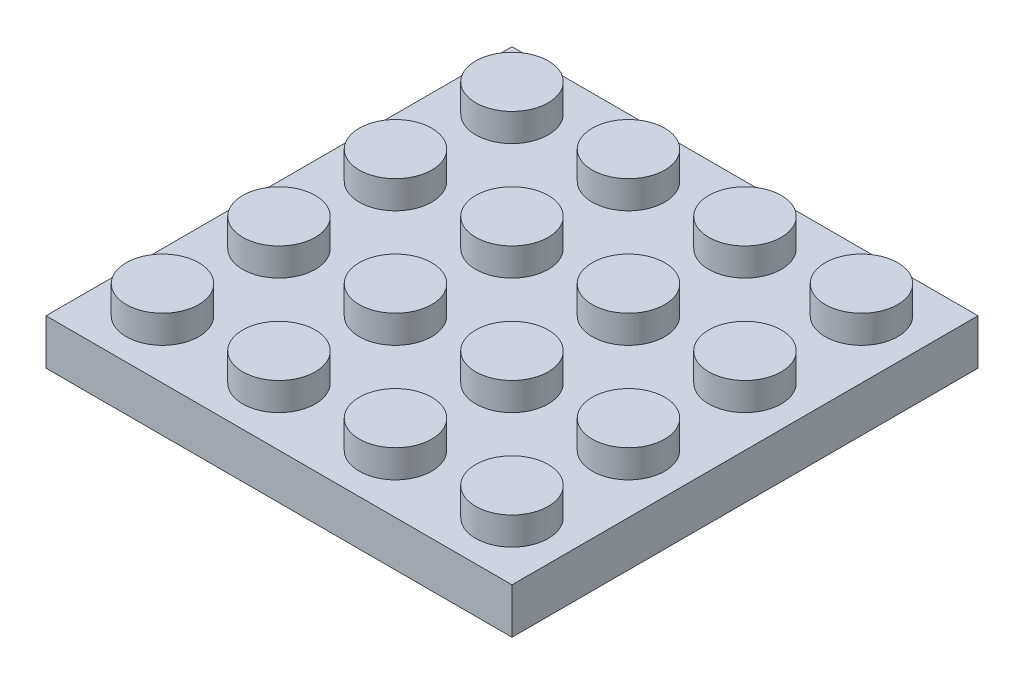
from build123d import *

# Parameters (mm, degrees)
SKETCH1_W           = 31.8
SKETCH1_H           = 31.8
BOSS_EXTRUDE1_DEPTH = 3.1
SKETCH2_W           = 28.8
SKETCH2_H           = 28.8
CUT_EXTRUDE1_DEPTH  = 1.9
SKETCH3_R           = 2.475
BOSS_EXTRUDE2_DEPTH = 1.9


with BuildPart() as part:
    # Sketch1 → Boss-Extrude1 (new body)
    with BuildSketch(Plane(origin=(0, 0, 0), x_dir=(1, 0, 0), z_dir=(0, 1, 0))):
        with Locations((-34.664493697, 17.966451592)):
            Rectangle(SKETCH1_W, SKETCH1_H)
    extrude(amount=BOSS_EXTRUDE1_DEPTH)

    # Sketch2 → Cut-Extrude1 (cut)
    with BuildSketch(Plane.XZ):
        with Locations((-34.664493697, -17.966451592)):
            Rectangle(SKETCH2_W, SKETCH2_H)
    extrude(amount=-CUT_EXTRUDE1_DEPTH, mode=Mode.SUBTRACT)

    # Sketch3 → Boss-Extrude2 (add)
    with BuildSketch(Plane(origin=(0, 3.1, 0), x_dir=(1, 0, 0), z_dir=(0, 1, 0))):
        with Locations(Location((-46.589493697, 29.891451592, 0), (0, 0, 90))):
            Circle(SKETCH3_R)
        with Locations(Location((-30.689493697, 29.891451592, 0), (0, 0, 90))):
            Circle(SKETCH3_R)
        with Locations(Location((-38.639493697, 29.891451592, 0), (0, 0, 90))):
            Circle(SKETCH3_R)
        with Locations(Location((-22.739493697, 29.891451592, 0), (0, 0, 90))):
            Circle(SKETCH3_R)
        with Locations(Location((-46.589493697, 21.941451592, 0), (0, 0, 90))):
            Circle(SKETCH3_R)
        with Locations(Location((-38.639493697, 21.941451592, 0), (0, 0, 90))):
            Circle(SKETCH3_R)
        with Locations(Location((-30.689493697, 21.941451592, 0), (0, 0, 90))):
            Circle(SKETCH3_R)
        with Locations(Location((-22.739493697, 21.941451592, 0), (0, 0, 90))):
            Circle(SKETCH3_R)
        with Locations(Location((-22.739493697, 13.991451592, 0), (0, 0, 90))):
            Circle(SKETCH3_R)
        with Locations(Location((-22.739493697, 6.041451592, 0), (0, 0, 90))):
            Circle(SKETCH3_R)
        with Locations(Location((-30.689493697, 13.991451592, 0), (0, 0, 90))):
            Circle(SKETCH3_R)
        with Locations(Location((-30.689493697, 6.041451592, 0), (0, 0, 90))):
            Circle(SKETCH3_R)
        with Locations(Location((-38.639493697, 13.991451592, 0), (0, 0, 90))):
            Circle(SKETCH3_R)
        with Locations(Location((-38.639493697, 6.041451592, 0), (0, 0, 90))):
            Circle(SKETCH3_R)
        with Locations(Location((-46.589493697, 13.991451592, 0), (0, 0, 90))):
            Circle(SKETCH3_R)
        with Locations(Location((-46.589493697, 6.041451592, 0), (0, 0, 90))):
            Circle(SKETCH3_R)
    extrude(amount=BOSS_EXTRUDE2_DEPTH)


solid = part.part
